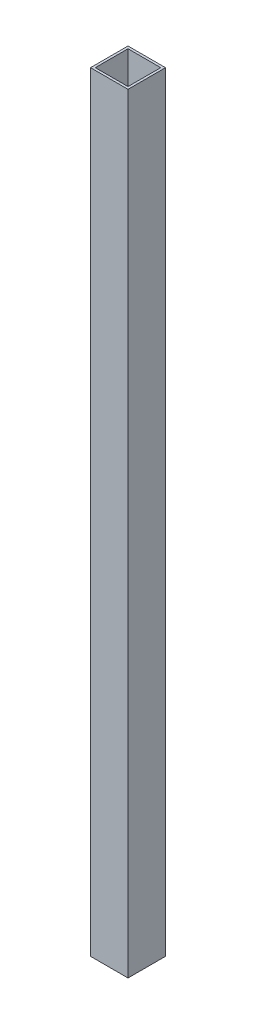
from build123d import *

# Parameters (mm, degrees)
SKETCH1_W           = 19
SKETCH1_H           = 19
SKETCH1_W_2         = 16.6
SKETCH1_H_2         = 16.6
BOSS_EXTRUDE1_DEPTH = 195


with BuildPart() as part:
    # Sketch1 → Boss-Extrude1 (new, symmetric)
    with BuildSketch(Plane(origin=(0, 0, 0), x_dir=(1, 0, 0), z_dir=(0, 1, 0))):
        Rectangle(SKETCH1_W, SKETCH1_H)
        Rectangle(SKETCH1_W_2, SKETCH1_H_2, mode=Mode.SUBTRACT)
    extrude(amount=BOSS_EXTRUDE1_DEPTH, both=True)


solid = part.part
